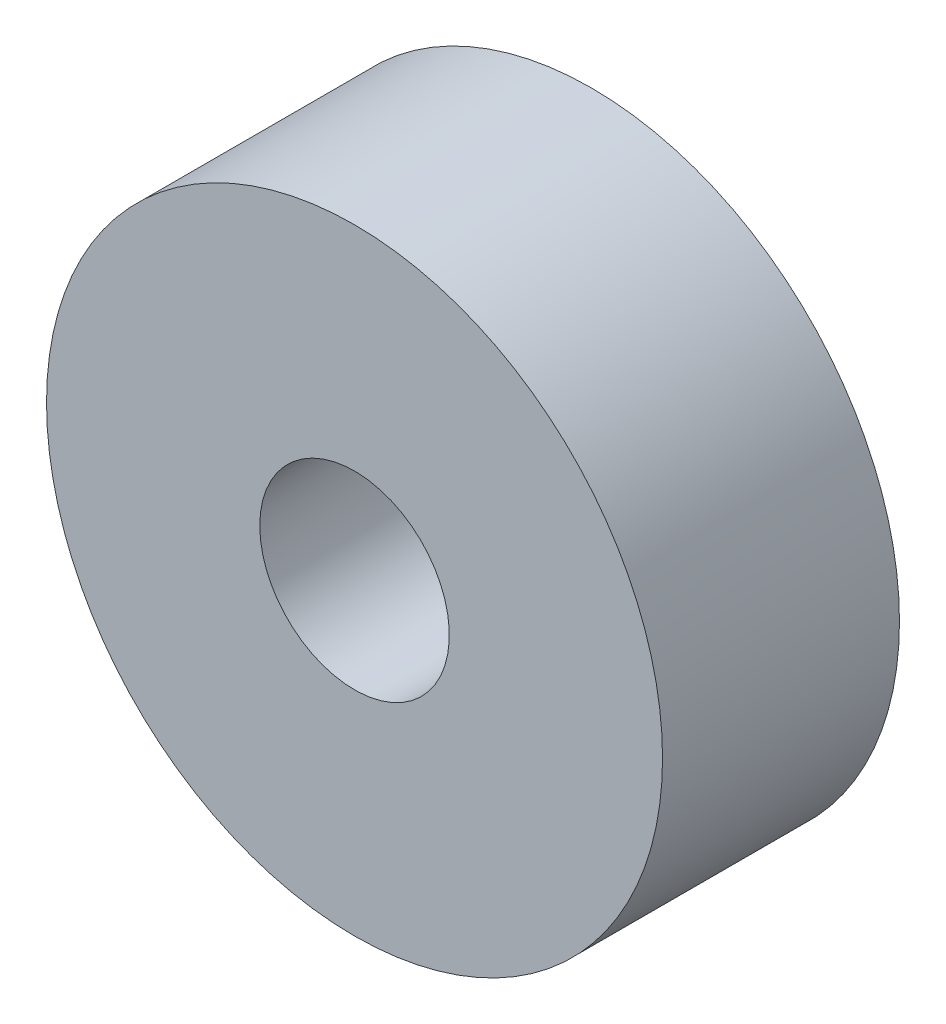
from build123d import *

# Parameters (mm, degrees)
ESQUISSE1_R             = 6.5
BOSS_EXTRU_1_DEPTH      = 5
ESQUISSE2_R             = 2
ENL_V_MAT_EXTRU_1_DEPTH = 5


with BuildPart() as part:
    # Esquisse1 → Boss.-Extru.1 (new body)
    with BuildSketch(Plane.XY):
        Circle(ESQUISSE1_R)
    extrude(amount=BOSS_EXTRU_1_DEPTH)

    # Esquisse2 → Enlèv. mat.-Extru.1 (cut)
    with BuildSketch(Plane(origin=(0, 0, 0), x_dir=(-1, 0, 0), z_dir=(0, 0, -1))):
        Circle(ESQUISSE2_R)
    extrude(amount=-ENL_V_MAT_EXTRU_1_DEPTH, mode=Mode.SUBTRACT)


solid = part.part
